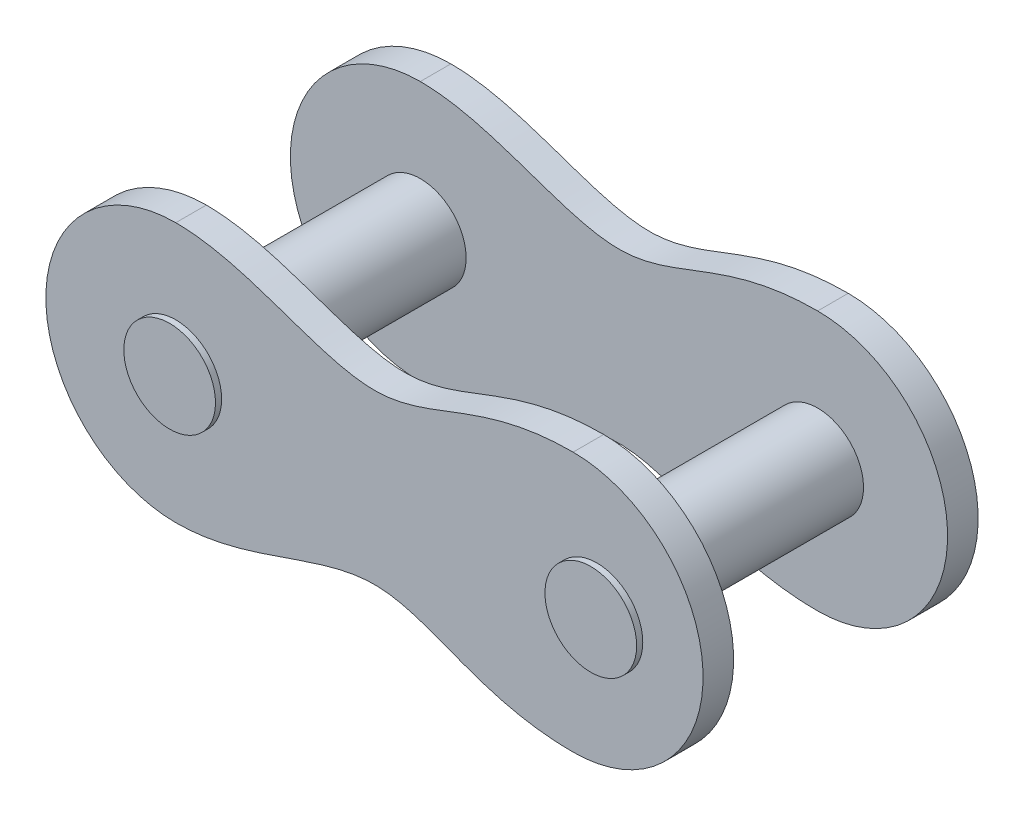
from build123d import *

# Parameters (mm, degrees)
SKETCH1_R               = 1.5
BOSS_EXTRUDE6_DEPTH     = 9
BOSS_EXTRUDE6_2_DEPTH   = 9
BOSS_EXTRUDE7_DEPTH     = 1
SKETCH6_R               = 1.5
BOSS_EXTRUDE8_DEPTH     = 0.2
CUT_EXTRUDE1_DEPTH      = 21.485726843
CUT_EXTRUDE1_DEPTH_BACK = 21.485726843


with BuildPart() as part:
    # Sketch1 → Boss-Extrude6 (new body)
    with BuildSketch(Plane.XY):
        Circle(SKETCH1_R)
    extrude(amount=BOSS_EXTRUDE6_DEPTH)



with BuildPart() as body_2:
    # Sketch1 → Boss-Extrude6 2 (new body)
    with BuildSketch(Plane.XY):
        with Locations((13, 0)):
            Circle(SKETCH1_R)
    extrude(amount=BOSS_EXTRUDE6_2_DEPTH)


with BuildPart() as part_1:
    add(part.part)

    add(body_2.part)  # Boss-Extrude7 merges body 2
    # Sketch5 → Boss-Extrude7 (add)
    with BuildSketch(Plane.XY.offset(9)):
        with BuildLine():
            ThreePointArc((0, 4.25), (-4.25, 0), (0, -4.25))
            add(Edge.make_bspline(
                [(0, -4.25), (2.386303511, -4.25), (6.863643386, -1.25), (9.886409718, -4.25), (13, -4.25)],
                knots=[0, 0, 0, 0, 0.5, 1, 1, 1, 1], degree=3))
            ThreePointArc((13, -4.25), (17.25, 0), (13, 4.25))
            add(Edge.make_bspline(
                [(0, 4.25), (2.386303511, 4.25), (6.863643386, 1.25), (9.886409718, 4.25), (13, 4.25)],
                knots=[0, 0, 0, 0, 0.5, 1, 1, 1, 1], degree=3))
        make_face()
    boss_extrude7 = extrude(amount=BOSS_EXTRUDE7_DEPTH)

    # Sketch6 → Boss-Extrude8 (add)
    with BuildSketch(Plane.XY.offset(10)):
        Circle(SKETCH6_R)
        with Locations((13.777718246, 0)):
            Circle(SKETCH6_R)
    boss_extrude8 = extrude(amount=BOSS_EXTRUDE8_DEPTH)

    # Sketch8 → Cut-Extrude1 (cut, two sides: drawn at the far end of the back side and taken through both)
    with BuildSketch(Plane(origin=(0, 0, 0), x_dir=(0, 0, -1), z_dir=(1, 0, 0)).offset(-CUT_EXTRUDE1_DEPTH_BACK)):
        Polygon((0, 0), (0, 2.418260543), (-2, 2.418260543), (-2, -2.301811822), (0, -2.301811822), align=None)
    extrude(amount=CUT_EXTRUDE1_DEPTH + CUT_EXTRUDE1_DEPTH_BACK, mode=Mode.SUBTRACT)

    # Mirror1: Boss-Extrude7, Boss-Extrude8 across plane
    add(boss_extrude7.mirror(Plane(origin=(0, 0, 5.5), x_dir=(1, 0, 0), z_dir=(0, 0, -1))))
    add(boss_extrude8.mirror(Plane(origin=(0, 0, 5.5), x_dir=(1, 0, 0), z_dir=(0, 0, -1))))


solid = part_1.part
